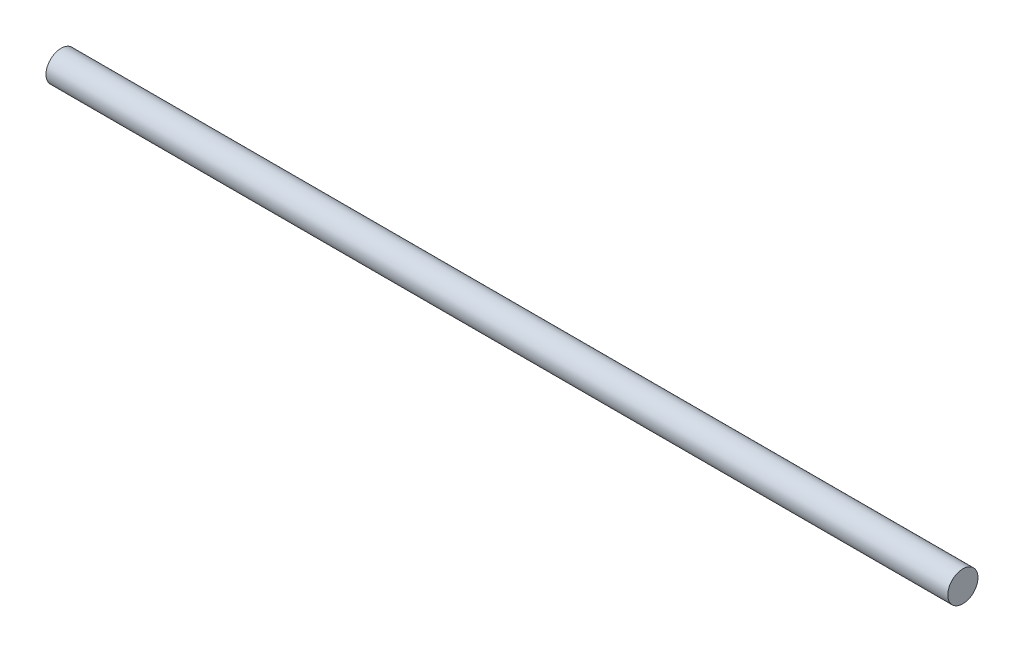
from build123d import *

# Parameters (mm, degrees)
SKETCH1_R           = 2.35
BOSS_EXTRUDE1_DEPTH = 70


with BuildPart() as part:
    # Sketch1 → Boss-Extrude1 (new, symmetric)
    with BuildSketch(Plane(origin=(0, 0, 0), x_dir=(0, 0, -1), z_dir=(1, 0, 0))):
        Circle(SKETCH1_R)
    extrude(amount=BOSS_EXTRUDE1_DEPTH, both=True)


solid = part.part
